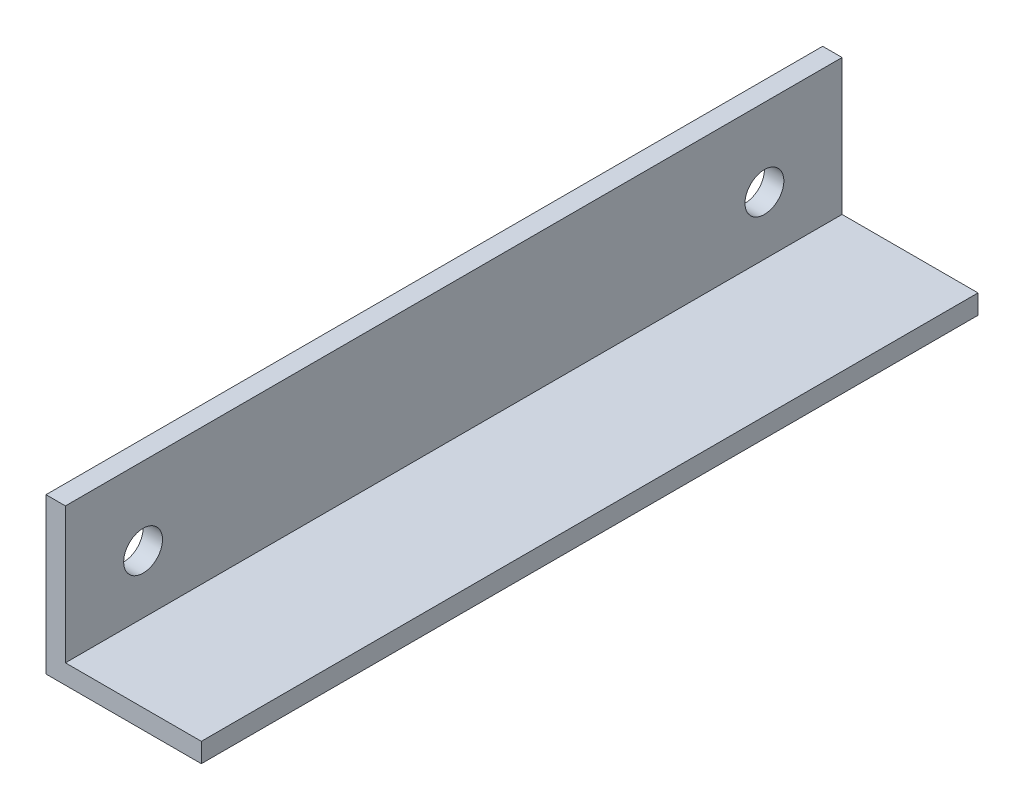
from build123d import *

# Parameters (mm, degrees)
BOSS_EXTRUDE1_DEPTH = 63.5
SKETCH2_R           = 3.175
CUT_EXTRUDE1_DEPTH  = 127


with BuildPart() as part:
    # Sketch1 → Boss-Extrude1 (new, symmetric)
    with BuildSketch(Plane.XY):
        Polygon((6.500914077, 0), (-18.899085923, 0), (-18.899085923, 25.4), (-15.724085923, 25.4), (-15.724085923, 3.175), (6.500914077, 3.175), align=None)
    extrude(amount=BOSS_EXTRUDE1_DEPTH, both=True)

    # Sketch2 → Cut-Extrude1 (cut)
    with BuildSketch(Plane.ZY.offset(18.899085923)):
        with Locations((50.8, 12.7)):
            Circle(SKETCH2_R)
        with Locations(Location((-50.8, 12.7, 0), (0, 0, 270))):
            Circle(SKETCH2_R)
    extrude(amount=-CUT_EXTRUDE1_DEPTH, mode=Mode.SUBTRACT)


solid = part.part
